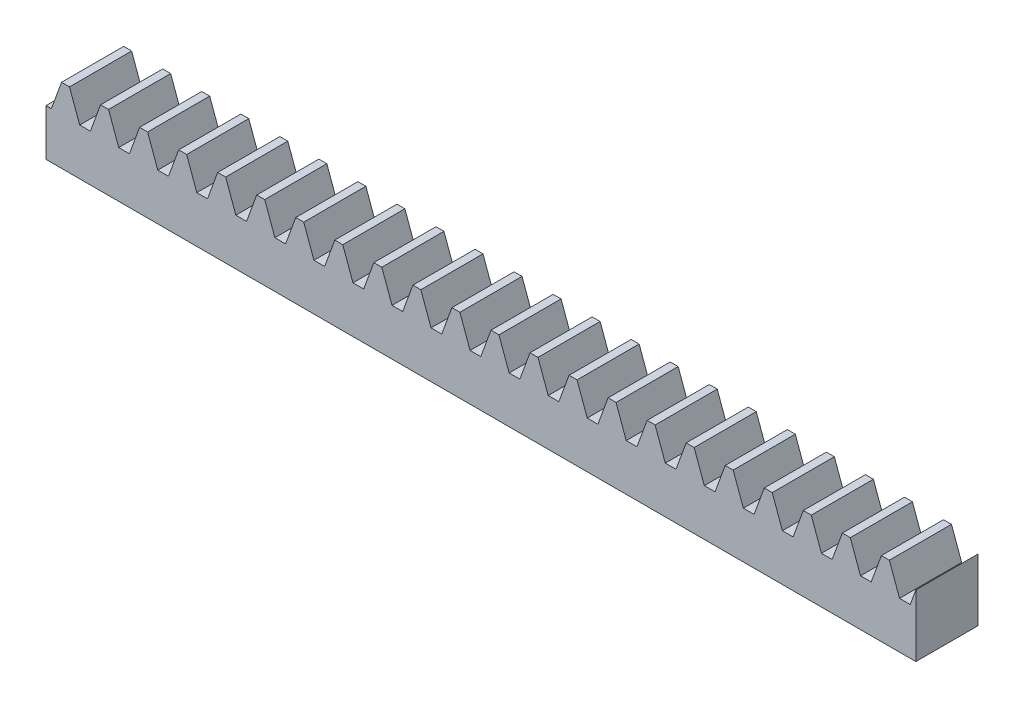
from build123d import *

# Parameters (mm, degrees)
BOSS_EXTRUDE1_DEPTH = 10


with BuildPart() as part:
    # Sketch1 → Boss-Extrude1 (new body)
    with BuildSketch(Plane(origin=(0, 0, -10.149759329), x_dir=(-1, 0, 0), z_dir=(0, 0, -1))):
        Polygon((-74.464294138, 2.144266729), (-76.102160192, -2.355733271), (-77.825901671, -2.355733271), (-78.733954331, 0.13912091), (-78.733954331, -9.855733271), (61.266045669, -9.855733271), (61.266045669, -2.355733271), (60.404174929, -2.355733271), (58.766308875, 2.144266729), (57.482597162, 2.144266729), (55.844731108, -2.355733271), (54.120989629, -2.355733271), (52.483123575, 2.144266729), (51.199411862, 2.144266729), (49.561545808, -2.355733271), (47.837804329, -2.355733271), (46.199938275, 2.144266729), (44.916226562, 2.144266729), (43.278360508, -2.355733271), (41.554619029, -2.355733271), (39.916752975, 2.144266729), (38.633041262, 2.144266729), (36.995175208, -2.355733271), (35.271433729, -2.355733271), (33.633567675, 2.144266729), (32.349855962, 2.144266729), (30.711989908, -2.355733271), (28.988248429, -2.355733271), (27.350382375, 2.144266729), (26.066670662, 2.144266729), (24.428804608, -2.355733271), (22.705063129, -2.355733271), (21.067197075, 2.144266729), (19.783485362, 2.144266729), (18.145619308, -2.355733271), (16.421877829, -2.355733271), (14.784011775, 2.144266729), (13.500300062, 2.144266729), (11.862434008, -2.355733271), (10.138692529, -2.355733271), (8.500826475, 2.144266729), (7.217114762, 2.144266729), (5.579248708, -2.355733271), (3.855507229, -2.355733271), (2.217641175, 2.144266729), (0.933929462, 2.144266729), (-0.703936592, -2.355733271), (-2.427678071, -2.355733271), (-4.065544125, 2.144266729), (-5.349255838, 2.144266729), (-6.987121892, -2.355733271), (-8.710863371, -2.355733271), (-10.348729425, 2.144266729), (-11.632441138, 2.144266729), (-13.270307192, -2.355733271), (-14.994048671, -2.355733271), (-16.631914725, 2.144266729), (-17.915626438, 2.144266729), (-19.553492492, -2.355733271), (-21.277233971, -2.355733271), (-22.915100025, 2.144266729), (-24.198811738, 2.144266729), (-25.836677792, -2.355733271), (-27.560419271, -2.355733271), (-29.198285325, 2.144266729), (-30.481997038, 2.144266729), (-32.119863092, -2.355733271), (-33.843604571, -2.355733271), (-35.481470625, 2.144266729), (-36.765182338, 2.144266729), (-38.403048392, -2.355733271), (-40.126789871, -2.355733271), (-41.764655925, 2.144266729), (-43.048367638, 2.144266729), (-44.686233692, -2.355733271), (-46.409975171, -2.355733271), (-48.047841225, 2.144266729), (-49.331552938, 2.144266729), (-50.969418992, -2.355733271), (-52.693160471, -2.355733271), (-54.331026525, 2.144266729), (-55.614738238, 2.144266729), (-57.252604292, -2.355733271), (-58.976345771, -2.355733271), (-60.614211825, 2.144266729), (-61.897923538, 2.144266729), (-63.535789592, -2.355733271), (-65.259531071, -2.355733271), (-66.897397125, 2.144266729), (-68.181108838, 2.144266729), (-69.818974892, -2.355733271), (-71.542716371, -2.355733271), (-73.180582425, 2.144266729), align=None)
    extrude(amount=-BOSS_EXTRUDE1_DEPTH)


solid = part.part
